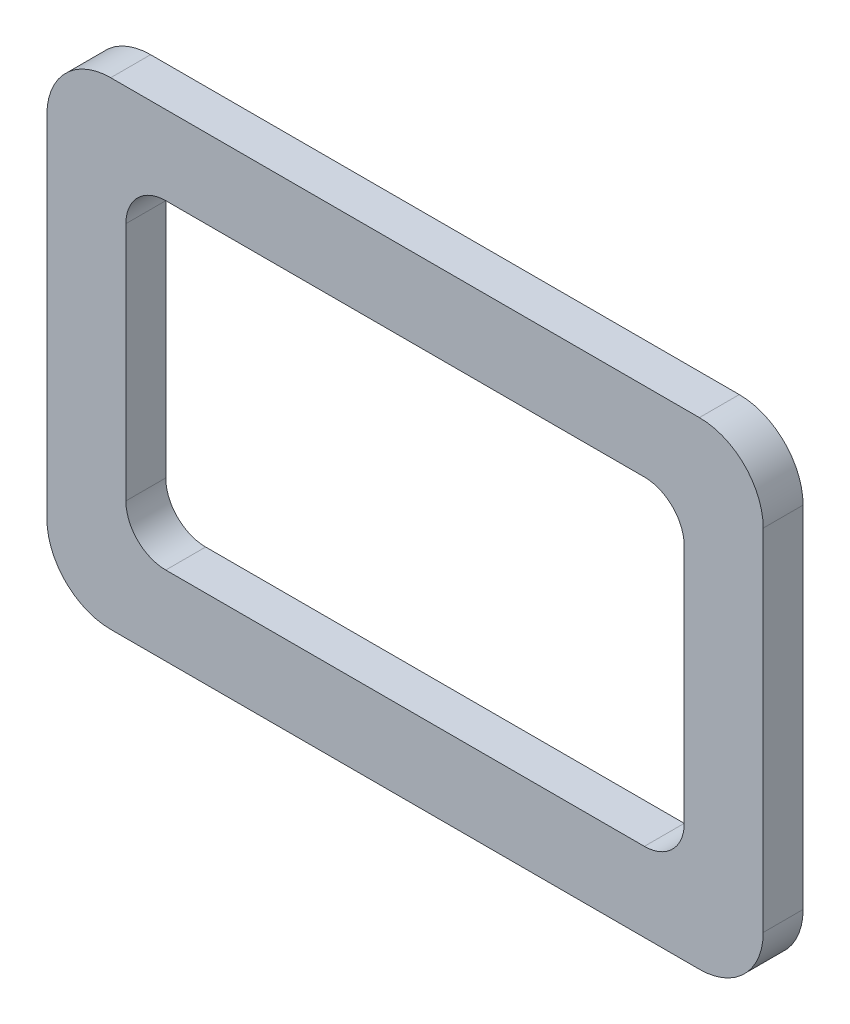
from build123d import *

# Parameters (mm, degrees)
BOSS_EXTRUDE1_DEPTH = 5
FILLET1_R           = 8
FILLET3_R           = 5


with BuildPart() as part:
    # Sketch1 → Boss-Extrude1 (new body)
    with BuildSketch(Plane.XY):
        Polygon((49.511947656, -13.648927203), (4.611947656, -13.648927203), (4.611947656, 46.251072797), (49.511947656, 46.251072797), (49.511947656, 36.351072797), (14.511947656, 36.351072797), (14.511947656, -3.748927203), (49.511947656, -3.748927203), align=None)
    boss_extrude1 = extrude(amount=BOSS_EXTRUDE1_DEPTH)

    # Mirror1: Boss-Extrude1 across plane
    add(boss_extrude1.mirror(Plane(origin=(49.511947656, 0, 0), x_dir=(0, 0, 1), z_dir=(1, 0, 0))))

    # Fillet1
    fillet1_edges = [part.edges().sort_by_distance(p)[0] for p in [
        (4.611947656, -13.648927203, 2.5),
        (4.611947656, 46.251072797, 2.5),
        (94.411947656, -13.648927203, 2.5),
        (94.411947656, 46.251072797, 2.5),
    ]]
    fillet(fillet1_edges, radius=FILLET1_R)

    # Fillet3
    fillet3_edges = [part.edges().sort_by_distance(p)[0] for p in [
        (14.511947656, 36.351072797, 2.5),
        (14.511947656, -3.748927203, 2.5),
        (84.511947656, 36.351072797, 2.5),
        (84.511947656, -3.748927203, 2.5),
    ]]
    fillet(fillet3_edges, radius=FILLET3_R)


solid = part.part
